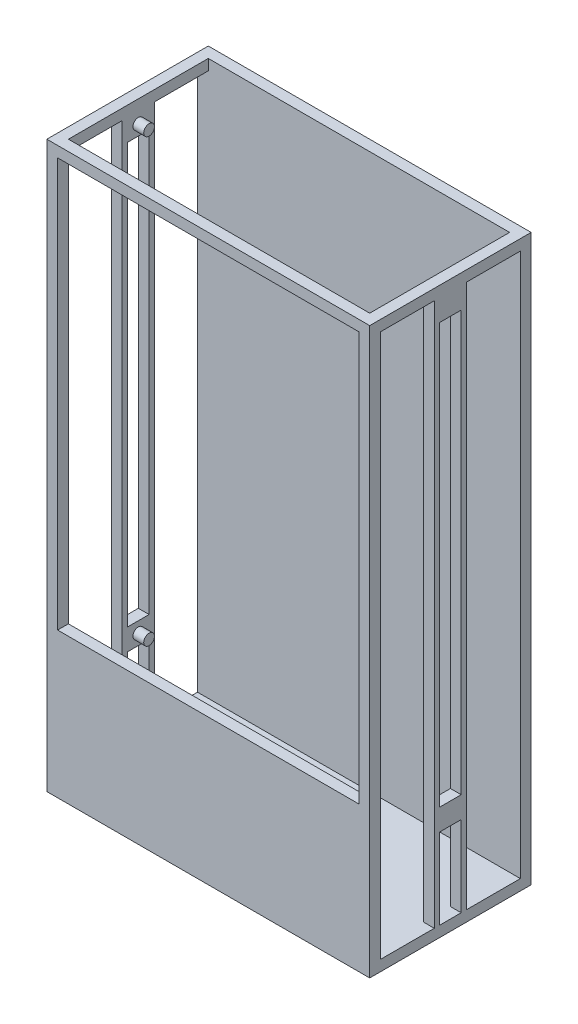
from build123d import *

# Parameters (mm, degrees)
SKETCH1_W            = 3000
SKETCH1_H            = 5000
BOSS_EXTRUDE1_DEPTH  = 100
SKETCH2_W            = 3000
SKETCH2_H            = 100
BOSS_EXTRUDE2_DEPTH  = 1400
SKETCH3_W            = 100
SKETCH3_H            = 100
BOSS_EXTRUDE3_DEPTH  = 4900
SKETCH4_W            = 100
SKETCH4_H            = 100
BOSS_EXTRUDE4_DEPTH  = 4900
SKETCH6_W            = 100
SKETCH6_H            = 1000
BOSS_EXTRUDE5_DEPTH  = 2800
SKETCH22_W           = 300
SKETCH22_H           = 4900
BOSS_EXTRUDE17_DEPTH = 100
SKETCH23_W           = 300
SKETCH23_H           = 4900
BOSS_EXTRUDE18_DEPTH = 100
SKETCH24_W           = 200
SKETCH24_H           = 4900
CUT_EXTRUDE1_DEPTH   = 6021.797289396
SKETCH25_W           = 200
SKETCH25_H           = 200
BOSS_EXTRUDE19_DEPTH = 100
SKETCH26_W           = 200
SKETCH26_H           = 200
BOSS_EXTRUDE20_DEPTH = 100
SKETCH31_W           = 1300
SKETCH31_H           = 100
BOSS_EXTRUDE23_DEPTH = 100
SKETCH33_W           = 1300
SKETCH33_H           = 100
BOSS_EXTRUDE24_DEPTH = 100
SKETCH43_W           = 1500
SKETCH43_H           = 250
BOSS_EXTRUDE32_DEPTH = 3000
SKETCH44_W           = 500
SKETCH44_H           = 250
CUT_EXTRUDE2_DEPTH   = 6230.967897189
SKETCH45_W           = 500
SKETCH45_H           = 250
CUT_EXTRUDE3_DEPTH   = 3000
SKETCH46_W           = 200
SKETCH46_H           = 250
CUT_EXTRUDE4_DEPTH   = 3000
SKETCH49_W           = 2800
SKETCH49_H           = 300
CUT_EXTRUDE5_DEPTH   = 250
SKETCH34_W           = 100
SKETCH34_H           = 100
BOSS_EXTRUDE25_DEPTH = 2800
SKETCH36_W           = 200
SKETCH36_H           = 200
BOSS_EXTRUDE26_DEPTH = 100
SKETCH37_W           = 200
SKETCH37_H           = 200
BOSS_EXTRUDE27_DEPTH = 100
SKETCH38_R           = 50
BOSS_EXTRUDE28_DEPTH = 100
SKETCH39_R           = 50
BOSS_EXTRUDE29_DEPTH = 100
BOSS_EXTRUDE30_START = 100
SKETCH40_R           = 50
BOSS_EXTRUDE30_DEPTH = 100
BOSS_EXTRUDE31_START = 100
SKETCH42_R           = 50
BOSS_EXTRUDE31_DEPTH = 100


with BuildPart() as part:
    # Sketch1 → Boss-Extrude1 (new body)
    with BuildSketch(Plane.XY):
        with Locations((1500, -2500)):
            Rectangle(SKETCH1_W, SKETCH1_H)
    extrude(amount=BOSS_EXTRUDE1_DEPTH)

    # Sketch2 → Boss-Extrude2 (add)
    with BuildSketch(Plane.XY.offset(100)):
        with Locations((1500, -4950)):
            Rectangle(SKETCH2_W, SKETCH2_H)
    extrude(amount=BOSS_EXTRUDE2_DEPTH)

    # Sketch3 → Boss-Extrude3 (add)
    with BuildSketch(Plane(origin=(0, -4900, 0), x_dir=(1, 0, 0), z_dir=(0, 1, 0))):
        with Locations((50, -1450)):
            Rectangle(SKETCH3_W, SKETCH3_H)
    extrude(amount=BOSS_EXTRUDE3_DEPTH)

    # Sketch4 → Boss-Extrude4 (add)
    with BuildSketch(Plane(origin=(0, -4900, 0), x_dir=(1, 0, 0), z_dir=(0, 1, 0))):
        with Locations((2950, -1450)):
            Rectangle(SKETCH4_W, SKETCH4_H)
    extrude(amount=BOSS_EXTRUDE4_DEPTH)

    # Sketch6 → Boss-Extrude5 (add)
    with BuildSketch(Plane(origin=(100, 0, 0), x_dir=(0, 0, -1), z_dir=(1, 0, 0))):
        with Locations((-1450, -4400)):
            Rectangle(SKETCH6_W, SKETCH6_H)
    extrude(amount=BOSS_EXTRUDE5_DEPTH)

    # Sketch22 → Boss-Extrude17 (add)
    with BuildSketch(Plane(origin=(3000, 0, 0), x_dir=(0, 0, -1), z_dir=(1, 0, 0))):
        with Locations((-750, -2450)):
            Rectangle(SKETCH22_W, SKETCH22_H)
    extrude(amount=-BOSS_EXTRUDE17_DEPTH)

    # Sketch23 → Boss-Extrude18 (add)
    with BuildSketch(Plane.ZY):
        with Locations((750, -2450)):
            Rectangle(SKETCH23_W, SKETCH23_H)
    extrude(amount=-BOSS_EXTRUDE18_DEPTH)

    # Sketch24 → Cut-Extrude1 (cut, through all)
    with BuildSketch(Plane.ZY):
        with Locations((750, -2450)):
            Rectangle(SKETCH24_W, SKETCH24_H)
    extrude(amount=-CUT_EXTRUDE1_DEPTH, mode=Mode.SUBTRACT)

    # Sketch25 → Boss-Extrude19 (add)
    with BuildSketch(Plane.ZY):
        with Locations((750, -4300)):
            Rectangle(SKETCH25_W, SKETCH25_H)
    extrude(amount=-BOSS_EXTRUDE19_DEPTH)

    # Sketch26 → Boss-Extrude20 (add)
    with BuildSketch(Plane(origin=(3000, 0, 0), x_dir=(0, 0, -1), z_dir=(1, 0, 0))):
        with Locations((-750, -4300)):
            Rectangle(SKETCH26_W, SKETCH26_H)
    extrude(amount=-BOSS_EXTRUDE20_DEPTH)

    # Sketch31 → Boss-Extrude23 (add)
    with BuildSketch(Plane(origin=(3000, 0, 0), x_dir=(0, 0, -1), z_dir=(1, 0, 0))):
        with Locations((-750, -50)):
            Rectangle(SKETCH31_W, SKETCH31_H)
    extrude(amount=-BOSS_EXTRUDE23_DEPTH)

    # Sketch33 → Boss-Extrude24 (add)
    with BuildSketch(Plane.ZY):
        with Locations((750, -50)):
            Rectangle(SKETCH33_W, SKETCH33_H)
    extrude(amount=-BOSS_EXTRUDE24_DEPTH)

    # Sketch43 → Boss-Extrude32 (add)
    with BuildSketch(Plane.ZY):
        with Locations((750, -5125)):
            Rectangle(SKETCH43_W, SKETCH43_H)
    extrude(amount=-BOSS_EXTRUDE32_DEPTH)

    # Sketch44 → Cut-Extrude2 (cut, through all)
    with BuildSketch(Plane.ZY):
        with Locations((350, -5025)):
            Rectangle(SKETCH44_W, SKETCH44_H)
    extrude(amount=-CUT_EXTRUDE2_DEPTH, mode=Mode.SUBTRACT)

    # Sketch45 → Cut-Extrude3 (cut)
    with BuildSketch(Plane.ZY):
        with Locations((1150, -5025)):
            Rectangle(SKETCH45_W, SKETCH45_H)
    extrude(amount=-CUT_EXTRUDE3_DEPTH, mode=Mode.SUBTRACT)

    # Sketch46 → Cut-Extrude4 (cut)
    with BuildSketch(Plane.ZY):
        with Locations((750, -5025)):
            Rectangle(SKETCH46_W, SKETCH46_H)
    extrude(amount=-CUT_EXTRUDE4_DEPTH, mode=Mode.SUBTRACT)

    # Sketch49 → Cut-Extrude5 (cut)
    with BuildSketch(Plane(origin=(0, -4900, 0), x_dir=(1, 0, 0), z_dir=(0, 1, 0))):
        with Locations((1500, -750)):
            Rectangle(SKETCH49_W, SKETCH49_H)
    extrude(amount=-CUT_EXTRUDE5_DEPTH, mode=Mode.SUBTRACT)

    # Sketch34 → Boss-Extrude25 (add)
    with BuildSketch(Plane.ZY.offset(-2900)):
        with Locations((1450, -50)):
            Rectangle(SKETCH34_W, SKETCH34_H)
    extrude(amount=BOSS_EXTRUDE25_DEPTH)

    # Sketch36 → Boss-Extrude26 (add)
    with BuildSketch(Plane.ZY):
        with Locations((750, -200)):
            Rectangle(SKETCH36_W, SKETCH36_H)
    extrude(amount=-BOSS_EXTRUDE26_DEPTH)

    # Sketch37 → Boss-Extrude27 (add)
    with BuildSketch(Plane(origin=(3000, 0, 0), x_dir=(0, 0, -1), z_dir=(1, 0, 0))):
        with Locations((-750, -200)):
            Rectangle(SKETCH37_W, SKETCH37_H)
    extrude(amount=-BOSS_EXTRUDE27_DEPTH)

    # Sketch38 → Boss-Extrude28 (add)
    with BuildSketch(Plane(origin=(100, 0, 0), x_dir=(0, 0, -1), z_dir=(1, 0, 0))):
        with Locations(Location((-750, -4300, 0), (0, 0, 180))):
            Circle(SKETCH38_R)
    extrude(amount=BOSS_EXTRUDE28_DEPTH)

    # Sketch39 → Boss-Extrude29 (add)
    with BuildSketch(Plane(origin=(100, 0, 0), x_dir=(0, 0, -1), z_dir=(1, 0, 0))):
        with Locations(Location((-750, -200, 0), (0, 0, 180))):
            Circle(SKETCH39_R)
    extrude(amount=BOSS_EXTRUDE29_DEPTH)

    # Sketch40 → Boss-Extrude30 (add)
    with BuildSketch(Plane.ZY.offset(-2900).offset(BOSS_EXTRUDE30_START)):
        with Locations((750, -200)):
            Circle(SKETCH40_R)
    extrude(amount=-BOSS_EXTRUDE30_DEPTH)

    # Sketch42 → Boss-Extrude31 (add)
    with BuildSketch(Plane.ZY.offset(-2900).offset(BOSS_EXTRUDE31_START)):
        with Locations((750, -4300)):
            Circle(SKETCH42_R)
    extrude(amount=-BOSS_EXTRUDE31_DEPTH)


solid = part.part
